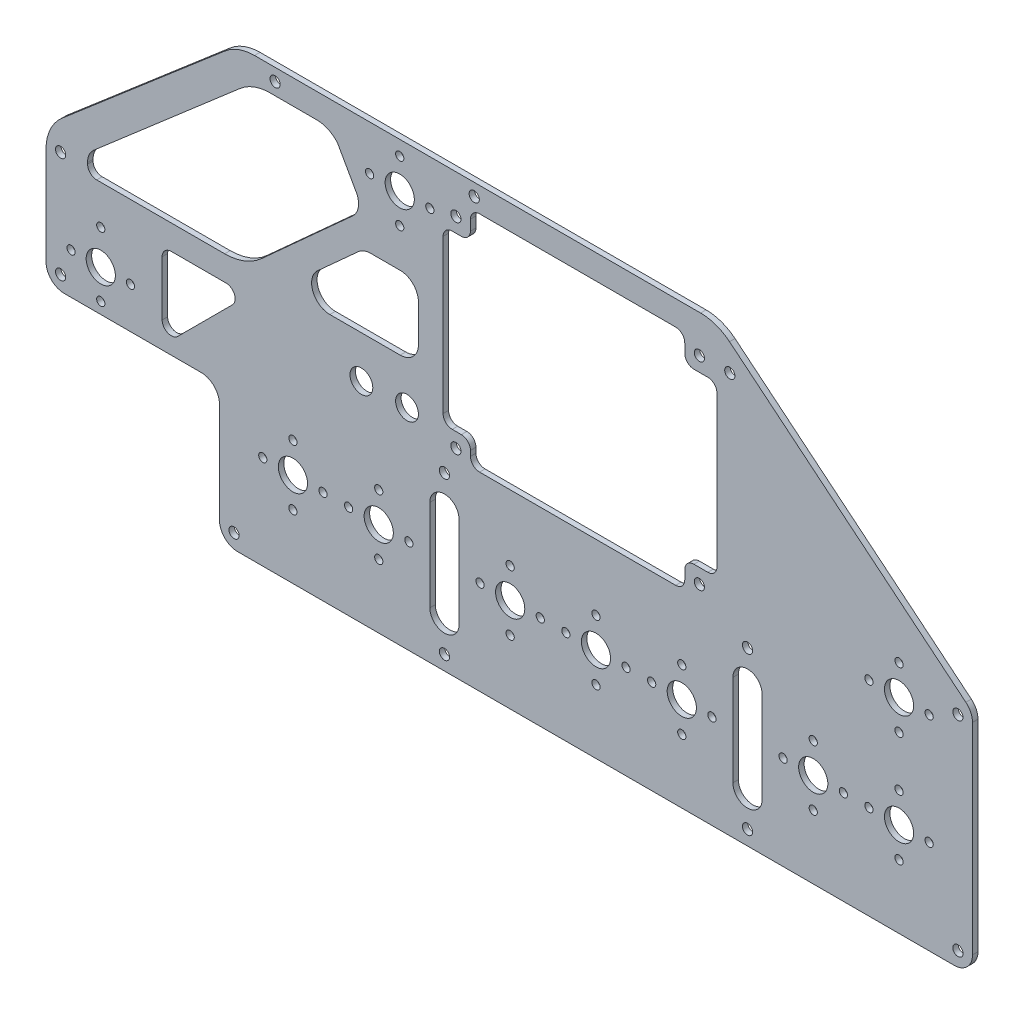
from build123d import *

# Parameters (mm, degrees)
SKETCH1_W           = 257.81
SKETCH1_H           = 1.524
BOSS_EXTRUDE1_DEPTH = 121.92
SKETCH3_R           = 4.064
SKETCH3_R_2         = 1.143
SKETCH3_R_3         = 1.4224
SKETCH3_R_4         = 3.175
CUT_EXTRUDE1_DEPTH  = 1.524


with BuildPart() as part:
    # Sketch1 → Boss-Extrude1 (new body)
    with BuildSketch(Plane(origin=(0, 0, 0), x_dir=(1, 0, 0), z_dir=(0, 1, 0))):
        Rectangle(SKETCH1_W, SKETCH1_H)
    extrude(amount=BOSS_EXTRUDE1_DEPTH)

    # Sketch3 → Cut-Extrude1 (cut)
    with BuildSketch(Plane.XY.offset(0.762)):
        with BuildLine():
            ThreePointArc((-75.565, 0), (-79.157102448, 1.487897552), (-80.645, 5.08))
            Line((-80.645, 5.08), (-80.645, 33.02))
            ThreePointArc((-80.645, 33.02), (-82.132897552, 36.612102448), (-85.725, 38.1))
            Line((-85.725, 38.1), (-123.825, 38.1))
            ThreePointArc((-123.825, 38.1), (-127.417102448, 39.587897552), (-128.905, 43.18))
            Line((-128.905, 43.18), (-128.905, 0))
            Line((-128.905, 0), (-75.565, 0))
        make_face()
        with BuildLine():
            ThreePointArc((128.905, 5.08), (127.417102448, 1.487897552), (123.825, 0))
            Line((123.825, 0), (128.905, 0))
            Line((128.905, 0), (128.905, 5.08))
        make_face()
        with BuildLine():
            ThreePointArc((127.049476271, 65.024180206), (128.417751869, 63.2696823), (128.905, 61.098730833))
            Line((128.905, 61.098730833), (128.905, 121.92))
            Line((128.905, 121.92), (53.237659058, 121.92))
            ThreePointArc((53.237659058, 121.92), (57.518837774, 121.176651237), (61.298849734, 119.033623432))
            Line((61.298849734, 119.033623432), (127.049476271, 65.024180206))
        make_face()
        with BuildLine():
            Line((-128.905, 121.92), (-128.905, 70.358826485))
            ThreePointArc((-128.905, 70.358826485), (-127.743113811, 75.665607966), (-124.470050443, 80.001385335))
            Line((-124.470050443, 80.001385335), (-79.132014675, 118.86255885))
            ThreePointArc((-79.132014675, 118.86255885), (-75.273181578, 121.131139689), (-70.866964232, 121.92))
            Line((-70.866964232, 121.92), (-128.905, 121.92))
        make_face()
        with BuildLine():
            Line((-74.893435538, 111.965503797), (-115.58156139, 76.756008745))
            ThreePointArc((-115.58156139, 76.756008745), (-116.877636425, 75.02643952), (-117.337402192, 72.914607226))
            Line((-117.337402192, 72.914607226), (-117.337402192, 72.517))
            ThreePointArc((-117.337402192, 72.517), (-116.593453417, 70.720948776), (-114.797402192, 69.977))
            Line((-114.797402192, 69.977), (-79.187622079, 69.977))
            ThreePointArc((-79.187622079, 69.977), (-73.705588554, 70.99712277), (-68.957458865, 73.920922778))
            Line((-68.957458865, 73.920922778), (-43.602839836, 96.883043682))
            ThreePointArc((-43.602839836, 96.883043682), (-41.9986235, 99.833854454), (-42.586303617, 103.140730071))
            Line((-42.586303617, 103.140730071), (-47.8155, 112.428238796))
            ThreePointArc((-47.8155, 112.428238796), (-50.409853837, 114.372351348), (-53.577602278, 115.062))
            Line((-53.577602278, 115.062), (-66.583037544, 115.062))
            ThreePointArc((-66.583037544, 115.062), (-71.017307596, 114.262724731), (-74.893435538, 111.965503797))
        make_face()
        with BuildLine():
            ThreePointArc((-13.97, 38.608), (-18.034, 42.672), (-22.098, 38.608))
            Line((-22.098, 38.608), (-22.098, 13.208))
            ThreePointArc((-22.098, 13.208), (-18.034, 9.144), (-13.97, 13.208))
            Line((-13.97, 13.208), (-13.97, 38.608))
        make_face()
        with BuildLine():
            Line((-78.806380775, 63.119), (-94.046380775, 63.119))
            ThreePointArc((-94.046380775, 63.119), (-95.842431999, 62.375051224), (-96.586380775, 60.579))
            Line((-96.586380775, 60.579), (-96.586380775, 45.339))
            ThreePointArc((-96.586380775, 45.339), (-95.018396693, 42.992345987), (-92.25032955, 43.542948776))
            Line((-92.25032955, 43.542948776), (-77.01032955, 58.782948776))
            ThreePointArc((-77.01032955, 58.782948776), (-76.459726762, 61.551015918), (-78.806380775, 63.119))
        make_face()
        with BuildLine():
            Line((-30.353, 90.398536083), (-38.588105657, 90.398536083))
            ThreePointArc((-38.588105657, 90.398536083), (-40.415450165, 90.05849516), (-41.998160062, 89.083895157))
            Line((-41.998160062, 89.083895157), (-53.328878993, 78.822359074))
            ThreePointArc((-53.328878993, 78.822359074), (-54.658783665, 73.229655492), (-49.918824588, 69.977))
            Line((-49.918824588, 69.977), (-30.353, 69.977))
            ThreePointArc((-30.353, 69.977), (-26.760897552, 71.464897552), (-25.273, 75.057))
            Line((-25.273, 75.057), (-25.273, 85.318536083))
            ThreePointArc((-25.273, 85.318536083), (-26.760897552, 88.910638532), (-30.353, 90.398536083))
        make_face()
        with BuildLine():
            Line((46.2915, 115.062), (-8.255, 115.062))
            ThreePointArc((-8.255, 115.062), (-10.051051224, 114.318051224), (-10.795, 112.522))
            Line((-10.795, 112.522), (-10.795, 109.638060608))
            ThreePointArc((-10.795, 109.638060608), (-11.538948776, 107.842009384), (-13.335, 107.098060608))
            Line((-13.335, 107.098060608), (-15.875, 107.098060608))
            ThreePointArc((-15.875, 107.098060608), (-17.671051224, 106.354111833), (-18.415, 104.558060608))
            Line((-18.415, 104.558060608), (-18.415, 61.872518739))
            ThreePointArc((-18.415, 61.872518739), (-17.671051224, 60.076467515), (-15.875, 59.332518739))
            Line((-15.875, 59.332518739), (-13.335, 59.332518739))
            ThreePointArc((-13.335, 59.332518739), (-11.538948776, 58.588569963), (-10.795, 56.792518739))
            Line((-10.795, 56.792518739), (-10.795, 55.372))
            ThreePointArc((-10.795, 55.372), (-10.051051224, 53.575948776), (-8.255, 52.832))
            Line((-8.255, 52.832), (46.291595758, 52.832))
            ThreePointArc((46.291595758, 52.832), (48.087646982, 53.575948776), (48.831595758, 55.372))
            Line((48.831595758, 55.372), (48.831595758, 57.912))
            ThreePointArc((48.831595758, 57.912), (49.575544533, 59.708051224), (51.371595758, 60.452))
            Line((51.371595758, 60.452), (55.245, 60.452))
            ThreePointArc((55.245, 60.452), (57.041051224, 61.195948776), (57.785, 62.992))
            Line((57.785, 62.992), (57.785, 104.902))
            ThreePointArc((57.785, 104.902), (57.041051224, 106.698051224), (55.245, 107.442))
            Line((55.245, 107.442), (51.3715, 107.442))
            ThreePointArc((51.3715, 107.442), (49.575448776, 108.185948776), (48.8315, 109.982))
            Line((48.8315, 109.982), (48.8315, 112.522))
            ThreePointArc((48.8315, 112.522), (48.087551224, 114.318051224), (46.2915, 115.062))
        make_face()
        with BuildLine():
            ThreePointArc((62.23, 13.208), (66.294, 9.144), (70.358, 13.208))
            Line((70.358, 13.208), (70.358, 38.608))
            ThreePointArc((70.358, 38.608), (66.294, 42.672), (62.23, 38.608))
            Line((62.23, 38.608), (62.23, 13.208))
        make_face()
        with Locations((-113.665, 49.53)):
            Circle(SKETCH3_R)
        with Locations((-113.665, 59.129542142)):
            Circle(SKETCH3_R_2)
        with Locations((-121.92, 49.53)):
            Circle(SKETCH3_R_2)
        with Locations((-113.665, 41.275)):
            Circle(SKETCH3_R_2)
        with Locations((-105.41, 49.53)):
            Circle(SKETCH3_R_2)
        with Locations((-60.198, 26.162)):
            Circle(SKETCH3_R)
        with Locations((-60.198, 34.544)):
            Circle(SKETCH3_R_2)
        with Locations((-51.816, 26.162)):
            Circle(SKETCH3_R_2)
        with Locations((-68.58, 26.162)):
            Circle(SKETCH3_R_2)
        with Locations((-60.198, 17.78)):
            Circle(SKETCH3_R_2)
        with Locations((24.13, 26.162)):
            Circle(SKETCH3_R)
        with Locations((24.13, 34.544)):
            Circle(SKETCH3_R_2)
        with Locations((24.13, 17.78)):
            Circle(SKETCH3_R_2)
        with Locations((15.748, 26.162)):
            Circle(SKETCH3_R_2)
        with Locations((32.512, 26.162)):
            Circle(SKETCH3_R_2)
        with Locations((108.458, 26.162)):
            Circle(SKETCH3_R)
        with Locations((108.458, 34.544)):
            Circle(SKETCH3_R_2)
        with Locations((108.458, 17.78)):
            Circle(SKETCH3_R_2)
        with Locations((100.076, 26.162)):
            Circle(SKETCH3_R_2)
        with Locations((116.84, 26.162)):
            Circle(SKETCH3_R_2)
        with Locations((-30.48, 109.474)):
            Circle(SKETCH3_R)
        with Locations((-30.48, 117.856)):
            Circle(SKETCH3_R_2)
        with Locations((-38.862, 109.474)):
            Circle(SKETCH3_R_2)
        with Locations((-22.098, 109.474)):
            Circle(SKETCH3_R_2)
        with Locations((-30.48, 101.092)):
            Circle(SKETCH3_R_2)
        with Locations((-76.581, 4.064)):
            Circle(SKETCH3_R_3)
        with Locations((-18.034, 4.064)):
            Circle(SKETCH3_R_3)
        with Locations((66.294, 4.064)):
            Circle(SKETCH3_R_3)
        with Locations((124.841, 4.064)):
            Circle(SKETCH3_R_3)
        with Locations((124.841, 60.960180206)):
            Circle(SKETCH3_R_3)
        with Locations((61.365659058, 111.506)):
            Circle(SKETCH3_R_3)
        with Locations((-9.754340942, 118.491)):
            Circle(SKETCH3_R_3)
        with Locations((-65.162014675, 118.491)):
            Circle(SKETCH3_R_3)
        with Locations((-124.841, 42.164)):
            Circle(SKETCH3_R_3)
        with Locations((-124.841, 71.628826485)):
            Circle(SKETCH3_R_3)
        with Locations((-18.034, 47.752)):
            Circle(SKETCH3_R_3)
        with Locations((66.294, 47.752)):
            Circle(SKETCH3_R_3)
        with Locations((-36.322, 34.544)):
            Circle(SKETCH3_R_2)
        with Locations((-36.322, 26.162)):
            Circle(SKETCH3_R)
        with Locations((-36.322, 17.78)):
            Circle(SKETCH3_R_2)
        with Locations((-27.94, 26.162)):
            Circle(SKETCH3_R_2)
        with Locations((-44.704, 26.162)):
            Circle(SKETCH3_R_2)
        with Locations((48.006, 26.162)):
            Circle(SKETCH3_R)
        with Locations((48.006, 34.544)):
            Circle(SKETCH3_R_2)
        with Locations((39.624, 26.162)):
            Circle(SKETCH3_R_2)
        with Locations((56.388, 26.162)):
            Circle(SKETCH3_R_2)
        with Locations((48.006, 17.78)):
            Circle(SKETCH3_R_2)
        with Locations((0.254, 26.162)):
            Circle(SKETCH3_R)
        with Locations((0.254, 34.544)):
            Circle(SKETCH3_R_2)
        with Locations((-8.128, 26.162)):
            Circle(SKETCH3_R_2)
        with Locations((8.636, 26.162)):
            Circle(SKETCH3_R_2)
        with Locations((0.254, 17.78)):
            Circle(SKETCH3_R_2)
        with Locations((84.582, 34.544)):
            Circle(SKETCH3_R_2)
        with Locations((84.582, 26.162)):
            Circle(SKETCH3_R)
        with Locations((76.2, 26.162)):
            Circle(SKETCH3_R_2)
        with Locations((84.582, 17.78)):
            Circle(SKETCH3_R_2)
        with Locations((92.964, 26.162)):
            Circle(SKETCH3_R_2)
        with Locations((-28.448, 58.293)):
            Circle(SKETCH3_R_4)
        with Locations((-41.148, 58.293)):
            Circle(SKETCH3_R_4)
        with Locations((-14.859, 55.268518739)):
            Circle(SKETCH3_R_3)
        with Locations((52.895595758, 56.388)):
            Circle(SKETCH3_R_3)
        with Locations((52.8955, 111.506)):
            Circle(SKETCH3_R_3)
        with Locations((-14.859, 111.162060608)):
            Circle(SKETCH3_R_3)
        with Locations((108.458, 56.896)):
            Circle(SKETCH3_R)
        with Locations((108.458, 65.278)):
            Circle(SKETCH3_R_2)
        with Locations((108.458, 48.514)):
            Circle(SKETCH3_R_2)
        with Locations((100.076, 56.896)):
            Circle(SKETCH3_R_2)
        with Locations((116.84, 56.896)):
            Circle(SKETCH3_R_2)
    extrude(amount=-CUT_EXTRUDE1_DEPTH, mode=Mode.SUBTRACT)


solid = part.part
